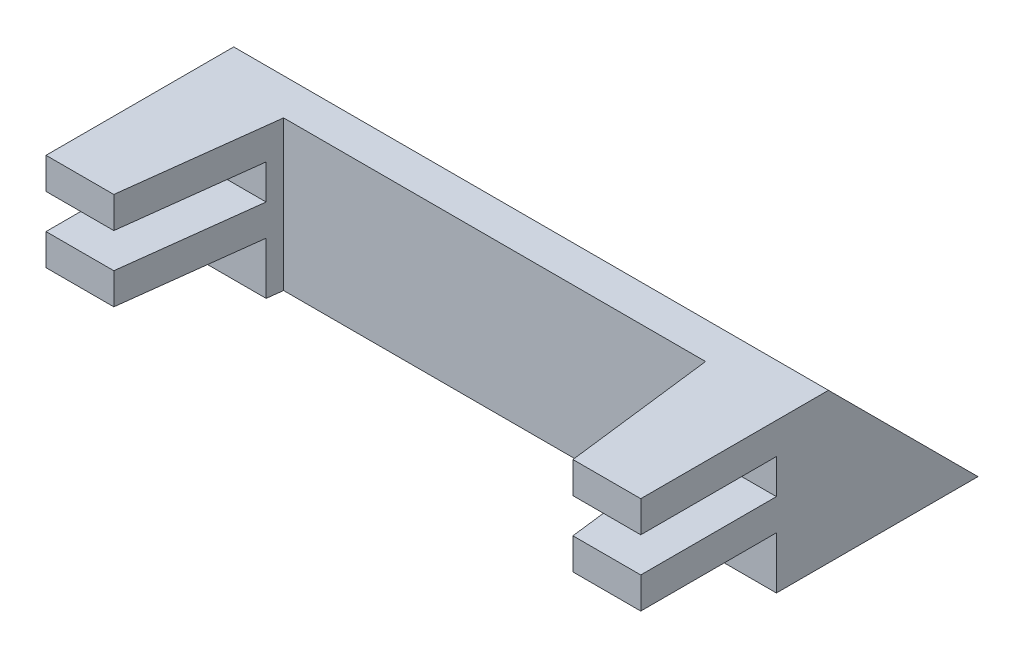
from build123d import *

# Parameters (mm, degrees)
BOSS_EXTRUDE1_DEPTH = 57
CUT_EXTRUDE1_REACH  = 63.868


with BuildPart() as part:
    # Sketch1 → Boss-Extrude1 (new body)
    with BuildSketch(Plane(origin=(0, 0, 0), x_dir=(0, 0, -1), z_dir=(1, 0, 0))):
        Polygon((0, 0), (19.32, 0), (4.99, 14.33), (-13, 14.33), (-13, 11.33), (0, 11.33), (0, 8), (-13, 8), (-13, 5), (0, 5), align=None)
    extrude(amount=-BOSS_EXTRUDE1_DEPTH)

    # Sketch2 → Cut-Extrude1 (cut, up to next)
    with BuildSketch(Plane(origin=(0, 14.33, 0), x_dir=(1, 0, 0), z_dir=(0, 1, 0)), mode=Mode.PRIVATE) as cut_extrude1_sk1:
        Polygon((-6.5, -13), (-8.279148287, 1.49), (-48.720851713, 1.49), (-50.5, -13), align=None)
    cut_extrude1_tool1 = extrude(cut_extrude1_sk1.sketch, amount=-CUT_EXTRUDE1_REACH, mode=Mode.PRIVATE) & part.part
    add(cut_extrude1_tool1.solids().sort_by_distance((-28.5, 14.33, 5.856766))[0], mode=Mode.SUBTRACT)


solid = part.part
